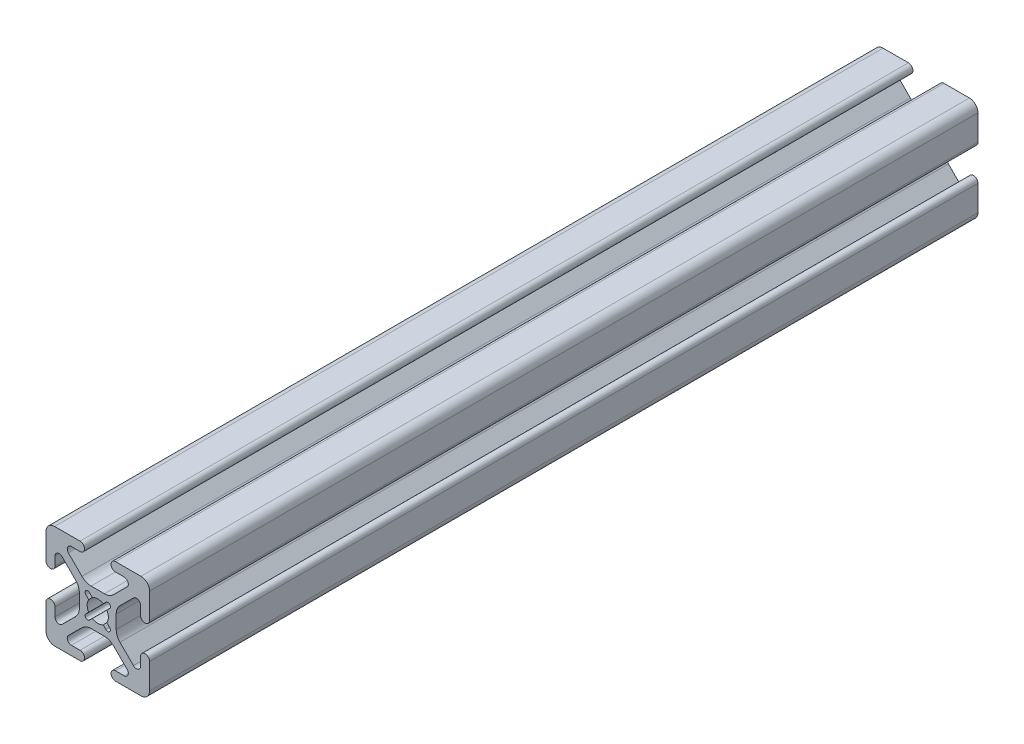
from build123d import *

# Parameters (mm, degrees)
EXTRUDE1_DEPTH = 203.2


with BuildPart() as part:
    # Sketch1 → Extrude1 (new body)
    with BuildSketch(Plane.XY):
        with BuildLine():
            Line((-3.88464389, 5.447103113), (-7.193320288, 8.75577951))
            ThreePointArc((-7.193320288, 8.75577951), (-7.413561403, 9.863006367), (-6.474899798, 10.4902))
            Line((-6.474899798, 10.4902), (-4.3561, 10.4902))
            ThreePointArc((-4.3561, 10.4902), (-3.2512, 11.5951), (-4.3561, 12.7))
            Line((-4.3561, 12.7), (-10.5918, 12.7))
            ThreePointArc((-10.5918, 12.7), (-12.082522516, 12.082522516), (-12.7, 10.5918))
            Line((-12.7, 10.5918), (-12.7, 4.3561))
            ThreePointArc((-12.7, 4.3561), (-11.5951, 3.2512), (-10.4902, 4.3561))
            Line((-10.4902, 4.3561), (-10.4902, 6.474899798))
            ThreePointArc((-10.4902, 6.474899798), (-9.863006367, 7.413561403), (-8.75577951, 7.193320288))
            Line((-8.75577951, 7.193320288), (-5.447103113, 3.88464389))
            ThreePointArc((-5.447103113, 3.88464389), (-4.758849627, 2.854599758), (-4.517167143, 1.63957986))
            Line((-4.517167143, 1.63957986), (-4.517167143, -1.63957986))
            ThreePointArc((-4.517167143, -1.63957986), (-4.758849627, -2.854599758), (-5.447103113, -3.88464389))
            Line((-5.447103113, -3.88464389), (-8.75577951, -7.193320288))
            ThreePointArc((-8.75577951, -7.193320288), (-9.863006367, -7.413561403), (-10.4902, -6.474899798))
            Line((-10.4902, -6.474899798), (-10.4902, -4.3561))
            ThreePointArc((-10.4902, -4.3561), (-11.5951, -3.2512), (-12.7, -4.3561))
            Line((-12.7, -4.3561), (-12.7, -10.5918))
            ThreePointArc((-12.7, -10.5918), (-12.082522516, -12.082522516), (-10.5918, -12.7))
            Line((-10.5918, -12.7), (-4.3561, -12.7))
            ThreePointArc((-4.3561, -12.7), (-3.2512, -11.5951), (-4.3561, -10.4902))
            Line((-4.3561, -10.4902), (-6.474899798, -10.4902))
            ThreePointArc((-6.474899798, -10.4902), (-7.413561403, -9.863006367), (-7.193320288, -8.75577951))
            Line((-7.193320288, -8.75577951), (-3.88464389, -5.447103113))
            ThreePointArc((-3.88464389, -5.447103113), (-2.854599758, -4.758849627), (-1.63957986, -4.517167143))
            Line((-1.63957986, -4.517167143), (1.63957986, -4.517167143))
            ThreePointArc((1.63957986, -4.517167143), (2.854599758, -4.758849627), (3.88464389, -5.447103113))
            Line((3.88464389, -5.447103113), (7.193320288, -8.75577951))
            ThreePointArc((7.193320288, -8.75577951), (7.413561403, -9.863006367), (6.474899798, -10.4902))
            Line((6.474899798, -10.4902), (4.3561, -10.4902))
            ThreePointArc((4.3561, -10.4902), (3.2512, -11.5951), (4.3561, -12.7))
            Line((4.3561, -12.7), (10.5918, -12.7))
            ThreePointArc((10.5918, -12.7), (12.082522516, -12.082522516), (12.7, -10.5918))
            Line((12.7, -10.5918), (12.7, -4.3561))
            ThreePointArc((12.7, -4.3561), (11.5951, -3.2512), (10.4902, -4.3561))
            Line((10.4902, -4.3561), (10.4902, -6.474899798))
            ThreePointArc((10.4902, -6.474899798), (9.863006367, -7.413561403), (8.75577951, -7.193320288))
            Line((8.75577951, -7.193320288), (5.447103113, -3.88464389))
            ThreePointArc((5.447103113, -3.88464389), (4.758849627, -2.854599758), (4.517167143, -1.63957986))
            Line((4.517167143, -1.63957986), (4.517167143, 1.63957986))
            ThreePointArc((4.517167143, 1.63957986), (4.758849627, 2.854599758), (5.447103113, 3.88464389))
            Line((5.447103113, 3.88464389), (8.75577951, 7.193320288))
            ThreePointArc((8.75577951, 7.193320288), (9.863006367, 7.413561403), (10.4902, 6.474899798))
            Line((10.4902, 6.474899798), (10.4902, 4.3561))
            ThreePointArc((10.4902, 4.3561), (11.5951, 3.2512), (12.7, 4.3561))
            Line((12.7, 4.3561), (12.7, 10.5918))
            ThreePointArc((12.7, 10.5918), (12.082522516, 12.082522516), (10.5918, 12.7))
            Line((10.5918, 12.7), (4.3561, 12.7))
            ThreePointArc((4.3561, 12.7), (3.2512, 11.5951), (4.3561, 10.4902))
            Line((4.3561, 10.4902), (6.474899798, 10.4902))
            ThreePointArc((6.474899798, 10.4902), (7.413561403, 9.863006367), (7.193320288, 8.75577951))
            Line((7.193320288, 8.75577951), (3.88464389, 5.447103113))
            ThreePointArc((3.88464389, 5.447103113), (2.854599758, 4.758849627), (1.63957986, 4.517167143))
            Line((1.63957986, 4.517167143), (-1.63957986, 4.517167143))
            ThreePointArc((-1.63957986, 4.517167143), (-2.854599758, 4.758849627), (-3.88464389, 5.447103113))
        make_face()
        with BuildLine():
            Line((-2.860474191, -1.969151357), (-2.231856263, -1.340533428))
            ThreePointArc((-2.231856263, -1.340533428), (-2.6035, 0), (-2.231856263, 1.340533428))
            Line((-2.231856263, 1.340533428), (-2.860474191, 1.969151357))
            ThreePointArc((-2.860474191, 1.969151357), (-2.918583239, 2.918583239), (-1.969151357, 2.860474191))
            Line((-1.969151357, 2.860474191), (-1.340533428, 2.231856263))
            ThreePointArc((-1.340533428, 2.231856263), (0, 2.6035), (1.340533428, 2.231856263))
            Line((1.340533428, 2.231856263), (1.969151357, 2.860474191))
            ThreePointArc((1.969151357, 2.860474191), (2.918583239, 2.918583239), (2.860474191, 1.969151357))
            Line((2.860474191, 1.969151357), (2.231856263, 1.340533428))
            ThreePointArc((2.231856263, 1.340533428), (2.6035, 0), (2.231856263, -1.340533428))
            Line((2.231856263, -1.340533428), (2.860474191, -1.969151357))
            ThreePointArc((2.860474191, -1.969151357), (2.918583239, -2.918583239), (1.969151357, -2.860474191))
            Line((1.969151357, -2.860474191), (1.340533428, -2.231856263))
            ThreePointArc((1.340533428, -2.231856263), (0, -2.6035), (-1.340533428, -2.231856263))
            Line((-1.340533428, -2.231856263), (-1.969151357, -2.860474191))
            ThreePointArc((-1.969151357, -2.860474191), (-2.918583239, -2.918583239), (-2.860474191, -1.969151357))
        make_face(mode=Mode.SUBTRACT)
    extrude(amount=-EXTRUDE1_DEPTH)


solid = part.part
